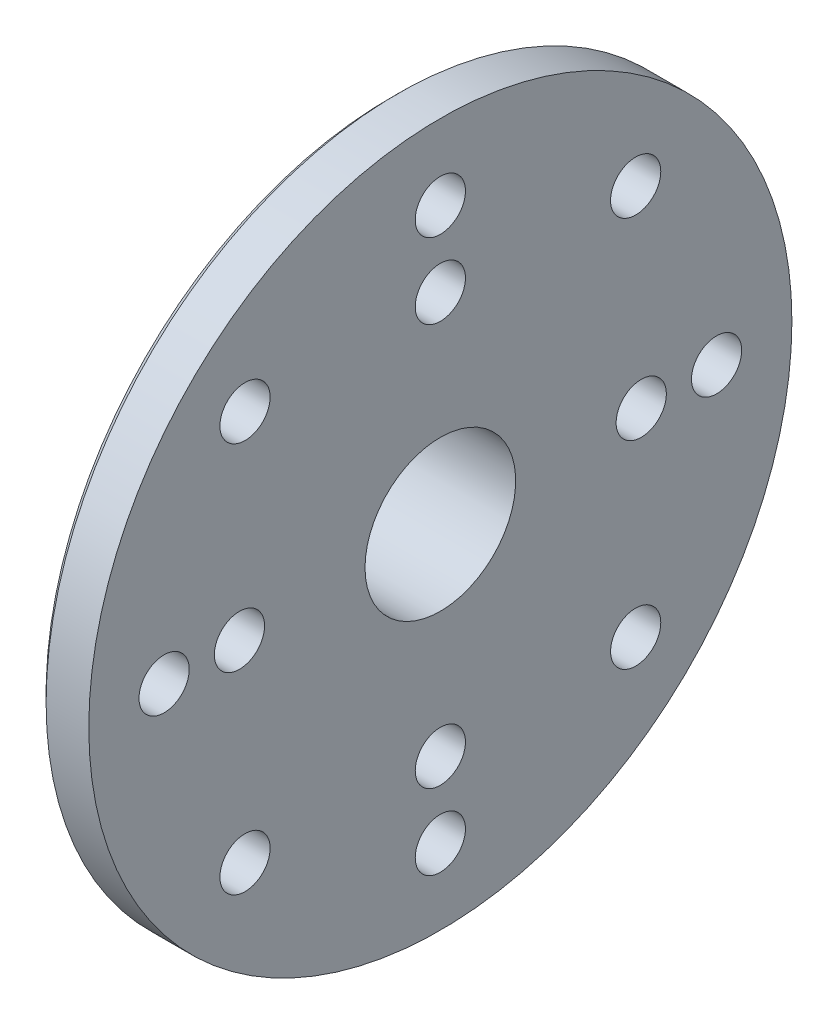
from build123d import *

# Parameters (mm, degrees)
SKETCH2_R          = 1
CUT_EXTRUDE1_DEPTH = 21.420577857
CIRPATTERN2_COUNT  = 8
SKETCH3_R          = 1
CUT_EXTRUDE2_DEPTH = 21.420577857
CIRPATTERN3_COUNT  = 4
CHAMFER1_SIZE      = 0.3


with BuildPart() as part:
    # Sketch1 → Revolve1 (revolve)
    with BuildSketch(Plane.XY):
        Polygon((-5, 3.75), (-2, 3.75), (-2, 14), (0, 14), (0, 3), (-4.5, 3), (-4.5, 1.5), (-5, 1.5), align=None)
    revolve(axis=Axis((0, 0, 0), (1, 0, 0)))

    # Sketch2 → Cut-Extrude1 (cut, through all)
    with BuildSketch(Plane(origin=(0, 0, 0), x_dir=(0, 0, -1), z_dir=(1, 0, 0))):
        with Locations((0, 11)):
            Circle(SKETCH2_R)
    cut_extrude1 = extrude(amount=-CUT_EXTRUDE1_DEPTH, mode=Mode.SUBTRACT)

    # CirPattern2: Cut-Extrude1 ×8 about axis
    cirpattern2_axis = Axis((0, 0, 0), (-1, 0, 0))
    for i in range(1, CIRPATTERN2_COUNT):
        add(cut_extrude1.rotate(cirpattern2_axis, i * 360 / CIRPATTERN2_COUNT), mode=Mode.SUBTRACT)

    # Sketch3 → Cut-Extrude2 (cut, through all)
    with BuildSketch(Plane(origin=(0, 0, 0), x_dir=(0, 0, -1), z_dir=(1, 0, 0))):
        with Locations((0, 8)):
            Circle(SKETCH3_R)
    cut_extrude2 = extrude(amount=-CUT_EXTRUDE2_DEPTH, mode=Mode.SUBTRACT)

    # CirPattern3: Cut-Extrude2 ×4 about axis
    cirpattern3_axis = Axis((0, 0, 0), (-1, 0, 0))
    for i in range(1, CIRPATTERN3_COUNT):
        add(cut_extrude2.rotate(cirpattern3_axis, i * 360 / CIRPATTERN3_COUNT), mode=Mode.SUBTRACT)

    # Chamfer1
    chamfer1_edges = [part.edges().sort_by_distance(p)[0] for p in [
        (-2, -14, 0),
        (-2, -3.75, 0),
        (-2, 11, 1),
        (-2, 8.485281374, -7.071067812),
        (-2, 1, -11),
        (-2, -7.071067812, -8.485281374),
        (-2, -11, -1),
        (-2, -8.485281374, 7.071067812),
        (-2, -1, 11),
        (-2, 7.071067812, 8.485281374),
        (-2, 8, 1),
        (-2, 1, -8),
        (-2, -8, -1),
        (-2, -1, 8),
        (-5, -3.75, 0),
    ]]
    chamfer(chamfer1_edges, length=CHAMFER1_SIZE)


solid = part.part
